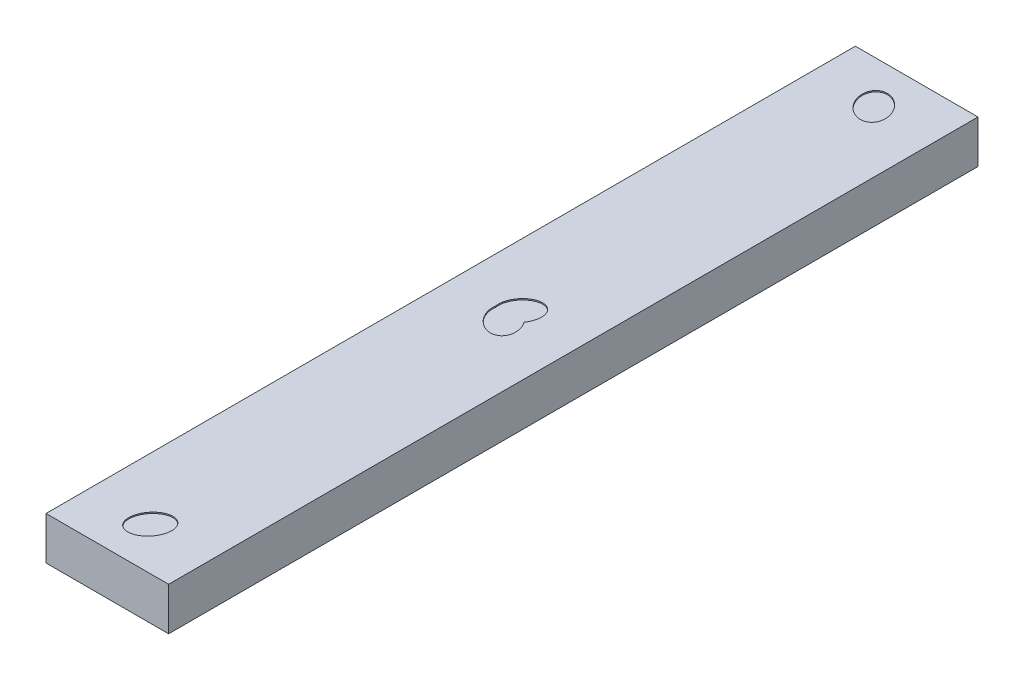
from build123d import *

# Parameters (mm, degrees)
CROQUIS1_W              = 20
CROQUIS1_H              = 132
SALIENTE_EXTRUIR1_DEPTH = 7
CROQUIS2_RX             = 3.2
CROQUIS2_RY             = 2.375
CORTAR_EXTRUIR1_DEPTH   = 0.2


with BuildPart() as part:
    # Croquis1 → Saliente-Extruir1 (new body)
    with BuildSketch(Plane(origin=(0, 0, 0), x_dir=(1, 0, 0), z_dir=(0, 1, 0))):
        Rectangle(CROQUIS1_W, CROQUIS1_H)
    extrude(amount=SALIENTE_EXTRUIR1_DEPTH)

    # Croquis2 → Cortar-Extruir1 (cut)
    with BuildSketch(Plane(origin=(0, 7, 0), x_dir=(1, 0, 0), z_dir=(0, 1, 0))):
        with Locations(Location((0.008026014, -59), (0, 0, -125.538109025))):
            Ellipse(CROQUIS2_RX, CROQUIS2_RY)
        with Locations(Location((0.000308673, 1.309257057), (0, 0, 54.461890975))):
            Ellipse(CROQUIS2_RX, CROQUIS2_RY)
        with Locations(Location((0.000308673, -1.309627052), (0, 0, -54.461890975))):
            Ellipse(CROQUIS2_RX, CROQUIS2_RY)
        with Locations(Location((0.008026014, 58.999630006), (0, 0, -54.461890975))):
            Ellipse(CROQUIS2_RX, CROQUIS2_RY)
    extrude(amount=-CORTAR_EXTRUIR1_DEPTH, mode=Mode.SUBTRACT)


solid = part.part
